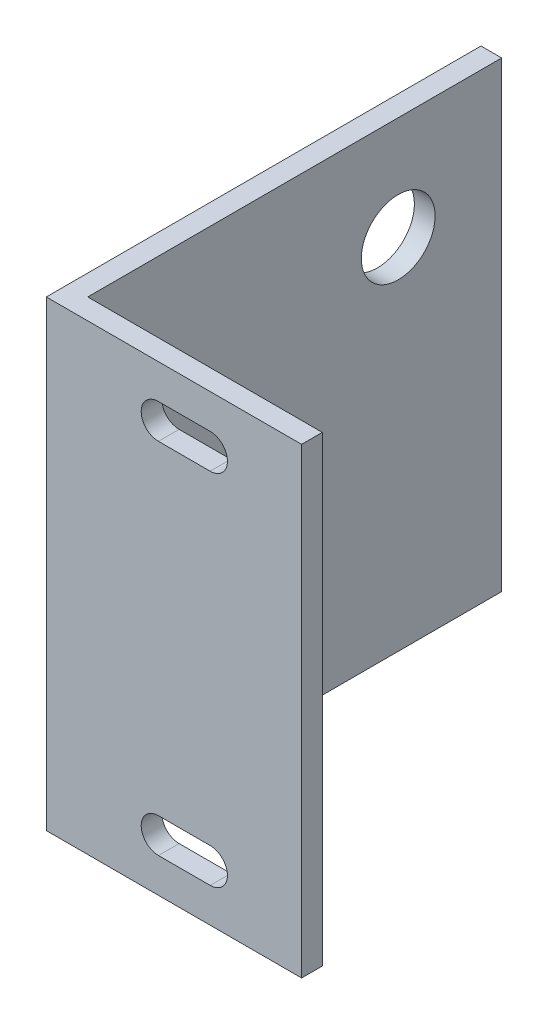
from build123d import *

# Parameters (mm, degrees)
BOSS_EXTRUDE1_DEPTH = 66.99
SKETCH2_R           = 5.35
CUT_EXTRUDE1_DEPTH  = 98.087126335
CUT_EXTRUDE2_DEPTH  = 92.814541877


with BuildPart() as part:
    # Sketch1 → Boss-Extrude1 (new body)
    with BuildSketch(Plane(origin=(0, 0, 0), x_dir=(1, 0, 0), z_dir=(0, 1, 0))):
        Polygon((-18.5, 1.5), (-18.5, 61.5), (-15.5, 61.5), (-15.5, 1.5), (18.5, 1.5), (18.5, -1.5), (-18.5, -1.5), align=None)
    extrude(amount=BOSS_EXTRUDE1_DEPTH)

    # Sketch2 → Cut-Extrude1 (cut, through all)
    with BuildSketch(Plane(origin=(-15.5, 0, 0), x_dir=(0, 0, -1), z_dir=(1, 0, 0))):
        with Locations((16.5, 15)):
            Circle(SKETCH2_R)
        with Locations((46.5, 51.988385001)):
            Circle(SKETCH2_R)
    extrude(amount=-CUT_EXTRUDE1_DEPTH, mode=Mode.SUBTRACT)

    # Sketch3 → Cut-Extrude2 (cut, through all)
    with BuildSketch(Plane(origin=(0, 0, -1.5), x_dir=(-1, 0, 0), z_dir=(0, 0, -1))):
        with BuildLine():
            Line((-5.25, 10), (2.25, 10))
            ThreePointArc((2.25, 10), (4.75, 7.5), (2.25, 5))
            Line((2.25, 5), (-5.25, 5))
            ThreePointArc((-5.25, 5), (-7.75, 7.5), (-5.25, 10))
        make_face()
        with BuildLine():
            Line((-5.25, 56.99), (2.25, 56.99))
            ThreePointArc((2.25, 56.99), (4.75, 59.49), (2.25, 61.99))
            Line((2.25, 61.99), (-5.25, 61.99))
            ThreePointArc((-5.25, 61.99), (-7.75, 59.49), (-5.25, 56.99))
        make_face()
    extrude(amount=-CUT_EXTRUDE2_DEPTH, mode=Mode.SUBTRACT)


solid = part.part
